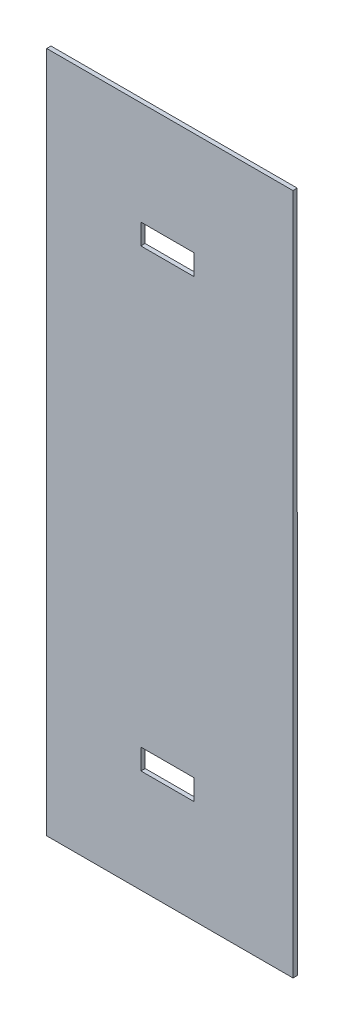
from build123d import *

# Parameters (mm, degrees)
BOSS_EXTRUDE1_DEPTH = 3


with BuildPart() as part:
    # Sketch1 → Boss-Extrude1 (new body)
    with BuildSketch(Plane.XY):
        Polygon((989.794405427, 1344.870125695), (989.713281448, 1823.934382844), (816.713281448, 1823.87268837), (816.713281448, 1344.808424352), align=None)
        Polygon((920.276734998, 1431.94331108), (882.933248531, 1431.912947905), (882.945057035, 1417.389739929), (920.288543502, 1417.420103104), align=None, mode=Mode.SUBTRACT)
        Polygon((882.824535058, 1736.81534774), (882.825987011, 1751.338560444), (920.169485635, 1751.334827041), (920.168033682, 1736.811614337), align=None, mode=Mode.SUBTRACT)
    extrude(amount=BOSS_EXTRUDE1_DEPTH)


solid = part.part
